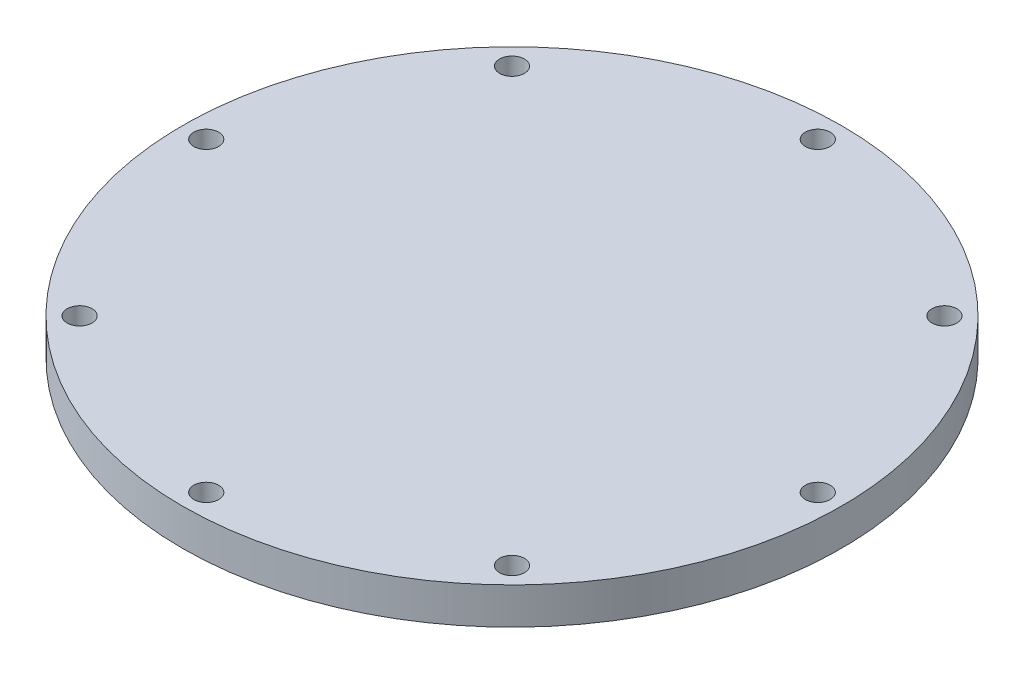
from build123d import *

# Parameters (mm, degrees)
SKETCH1_R             = 45
SKETCH1_R_2           = 1.5
BOSS_EXTRUDE2_DEPTH   = 5
SKETCH9_R             = 3.937
BOSS_EXTRUDE7_DEPTH   = 4
SKETCH10_R            = 1.7
CUT_EXTRUDE9_DEPTH    = 14
M3_TAPPED_HOLE1_D     = 2.5
M3_TAPPED_HOLE1_DEPTH = 7
M3_TAPPED_HOLE1_TIP   = 0.751075774


with BuildPart() as part:
    # Sketch1 → Boss-Extrude2 (new body)
    with BuildSketch(Plane(origin=(0, 0, 0), x_dir=(1, 0, 0), z_dir=(0, 1, 0))):
        with Locations(Location((0, 0, 0), (0, 0, 270))):
            Circle(SKETCH1_R)
        with Locations(Location((0, 41.75, 0), (0, 0, 270))):
            Circle(SKETCH1_R_2, mode=Mode.SUBTRACT)
        with Locations(Location((29.521708115, 29.521708115, 0), (0, 0, 270))):
            Circle(SKETCH1_R_2, mode=Mode.SUBTRACT)
        with Locations(Location((41.75, 0, 0), (0, 0, 270))):
            Circle(SKETCH1_R_2, mode=Mode.SUBTRACT)
        with Locations(Location((29.521708115, -29.521708115, 0), (0, 0, 270))):
            Circle(SKETCH1_R_2, mode=Mode.SUBTRACT)
        with Locations(Location((0, -41.75, 0), (0, 0, 270))):
            Circle(SKETCH1_R_2, mode=Mode.SUBTRACT)
        with Locations(Location((-29.521708115, -29.521708115, 0), (0, 0, 270))):
            Circle(SKETCH1_R_2, mode=Mode.SUBTRACT)
        with Locations(Location((-41.75, 0, 0), (0, 0, 270))):
            Circle(SKETCH1_R_2, mode=Mode.SUBTRACT)
        with Locations(Location((-29.521708115, 29.521708115, 0), (0, 0, 270))):
            Circle(SKETCH1_R_2, mode=Mode.SUBTRACT)
    extrude(amount=BOSS_EXTRUDE2_DEPTH)

    # Sketch9 → Boss-Extrude7 (add)
    with BuildSketch(Plane.XZ):
        with Locations(Location((27, 0, 0), (0, 0, 90))):
            Circle(SKETCH9_R)
        with Locations(Location((0, -27, 0), (0, 0, 90))):
            Circle(SKETCH9_R)
        with Locations(Location((-27, 0, 0), (0, 0, 90))):
            Circle(SKETCH9_R)
        with Locations(Location((0, 27, 0), (0, 0, 90))):
            Circle(SKETCH9_R)
    extrude(amount=BOSS_EXTRUDE7_DEPTH)

    # Sketch10 → Cut-Extrude9 (cut)
    with BuildSketch(Plane(origin=(0, 5, 0), x_dir=(1, 0, 0), z_dir=(0, 1, 0))):
        with Locations(Location((0, 41.75, 0), (0, 0, 270))):
            Circle(SKETCH10_R)
        with Locations(Location((29.521708115, 29.521708115, 0), (0, 0, 270))):
            Circle(SKETCH10_R)
        with Locations(Location((41.75, 0, 0), (0, 0, 270))):
            Circle(SKETCH10_R)
        with Locations(Location((29.521708115, -29.521708115, 0), (0, 0, 270))):
            Circle(SKETCH10_R)
        with Locations(Location((0, -41.75, 0), (0, 0, 270))):
            Circle(SKETCH10_R)
        with Locations(Location((-29.521708115, -29.521708115, 0), (0, 0, 270))):
            Circle(SKETCH10_R)
        with Locations(Location((-41.75, 0, 0), (0, 0, 270))):
            Circle(SKETCH10_R)
        with Locations(Location((-29.521708115, 29.521708115, 0), (0, 0, 270))):
            Circle(SKETCH10_R)
    extrude(amount=-CUT_EXTRUDE9_DEPTH, mode=Mode.SUBTRACT)

    # M3 Tapped Hole1
    with Locations(Plane.XZ.offset(4)):
        with Locations((0, 27), (27, 0), (0, -27), (-27, 0)):
            Hole(M3_TAPPED_HOLE1_D / 2, depth=M3_TAPPED_HOLE1_DEPTH)
            with Locations((0, 0, -(M3_TAPPED_HOLE1_DEPTH + M3_TAPPED_HOLE1_TIP / 2))):  # 118° drill point
                Cone(0, M3_TAPPED_HOLE1_D / 2, M3_TAPPED_HOLE1_TIP, mode=Mode.SUBTRACT)


solid = part.part
